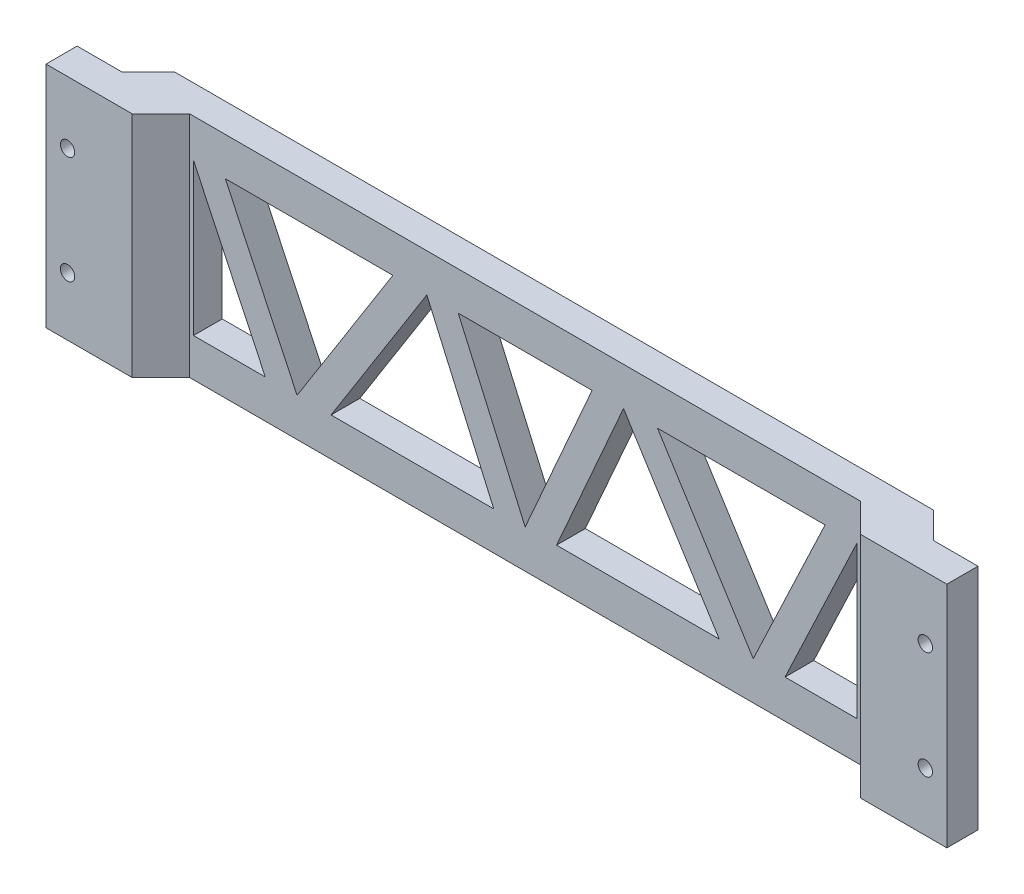
from build123d import *

# Parameters (mm, degrees)
EXTRUDE_1_DEPTH     = 47.7
CUT_EXTRUDE_1_DEPTH = 10
SKETCH_4_R          = 1.5
CUT_EXTRUDE_2_DEPTH = 10
SKETCH_6_R          = 2.5
CUT_EXTRUDE_4_DEPTH = 3


with BuildPart() as part:
    # 草图1 → 凸台-拉伸1 (new body)
    with BuildSketch(Plane(origin=(0, 0, 0), x_dir=(1, 0, 0), z_dir=(0, 1, 0))):
        Polygon((70.07, 0), (76.07, -6), (94.07, -6), (94.07, 0.5), (84.77, 0.5), (79.27, 6), (0, 6), (-79.27, 6), (-84.77, 0.5), (-94.07, 0.5), (-94.07, -6), (-76.07, -6), (-70.07, 0), align=None)
    extrude(amount=EXTRUDE_1_DEPTH)

    # 草图2 → 切除-拉伸1 (cut)
    with BuildSketch(Plane(origin=(0, 0, -6), x_dir=(-1, 0, 0), z_dir=(0, 0, -1))):
        Polygon((-69.27, 39.7), (-69.27, 8), (-54.27, 8), align=None)
        Polygon((-27.632185319, 39.7), (-62.632185319, 39.7), (-47.632185319, 8), align=None)
        Polygon((-40.537826527, 8), (-6.557580565, 8), (-20.537826527, 39.7), align=None)
        Polygon((-13.980245962, 39.7), (0, 8), (13.980245962, 39.7), align=None)
        Polygon((6.557580565, 8), (40.537826527, 8), (20.537826527, 39.7), align=None)
        Polygon((27.632185319, 39.7), (47.632185319, 8), (62.632185319, 39.7), align=None)
        Polygon((69.27, 39.7), (54.27, 8), (69.27, 8), align=None)
    extrude(amount=-CUT_EXTRUDE_1_DEPTH, mode=Mode.SUBTRACT)

    # 草图4 → 切除-拉伸2 (cut)
    with BuildSketch(Plane(origin=(0, 0, -0.5), x_dir=(-1, 0, 0), z_dir=(0, 0, -1))):
        with Locations((-89.57, 34.7)):
            Circle(SKETCH_4_R)
        with Locations((-89.57, 12.2)):
            Circle(SKETCH_4_R)
        with Locations((89.57, 34.7)):
            Circle(SKETCH_4_R)
        with Locations((89.57, 12.2)):
            Circle(SKETCH_4_R)
    extrude(amount=-CUT_EXTRUDE_2_DEPTH, mode=Mode.SUBTRACT)

    # 草图6 → 切除-拉伸4 (cut)
    with BuildSketch(Plane(origin=(0, 0, -0.5), x_dir=(-1, 0, 0), z_dir=(0, 0, -1))):
        with Locations((-89.57, 34.7)):
            Circle(SKETCH_6_R)
        with Locations((-89.57, 12.2)):
            Circle(SKETCH_6_R)
        with Locations((89.57, 34.7)):
            Circle(SKETCH_6_R)
        with Locations((89.57, 12.2)):
            Circle(SKETCH_6_R)
    extrude(amount=-CUT_EXTRUDE_4_DEPTH, mode=Mode.SUBTRACT)


solid = part.part
